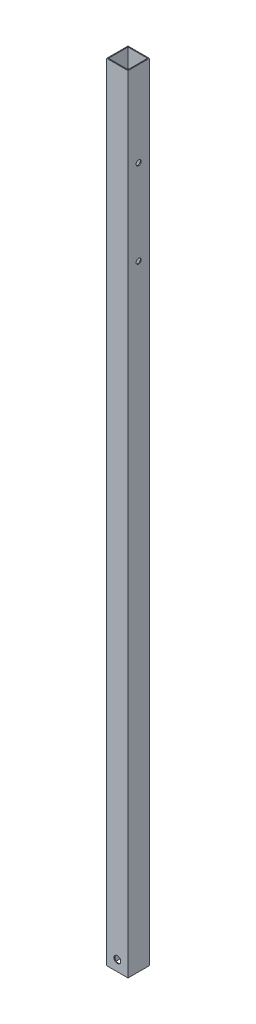
from build123d import *

# Parameters (mm, degrees)
SKETCH1_W           = 25
SKETCH1_H           = 25
SKETCH1_W_2         = 23
SKETCH1_H_2         = 23
BOSS_EXTRUDE1_DEPTH = 922.5
SKETCH2_R           = 3
CUT_EXTRUDE1_DEPTH  = 923.923344596
SKETCH3_R           = 4
CUT_EXTRUDE2_DEPTH  = 923.923344596


with BuildPart() as part:
    # Sketch1 → Boss-Extrude1 (new body)
    with BuildSketch(Plane(origin=(0, 0, 0), x_dir=(1, 0, 0), z_dir=(0, 1, 0))):
        Rectangle(SKETCH1_W, SKETCH1_H)
        Rectangle(SKETCH1_W_2, SKETCH1_H_2, mode=Mode.SUBTRACT)
    extrude(amount=BOSS_EXTRUDE1_DEPTH)

    # Sketch2 → Cut-Extrude1 (cut, through all)
    with BuildSketch(Plane(origin=(12.5, 0, 0), x_dir=(0, 0, -1), z_dir=(1, 0, 0))):
        with Locations((0, 822.5)):
            Circle(SKETCH2_R)
        with Locations((0, 722.5)):
            Circle(SKETCH2_R)
    extrude(amount=-CUT_EXTRUDE1_DEPTH, mode=Mode.SUBTRACT)

    # Sketch3 → Cut-Extrude2 (cut, through all)
    with BuildSketch(Plane.XY.offset(12.5)):
        with Locations((0, 12.5)):
            Circle(SKETCH3_R)
    extrude(amount=-CUT_EXTRUDE2_DEPTH, mode=Mode.SUBTRACT)


solid = part.part
